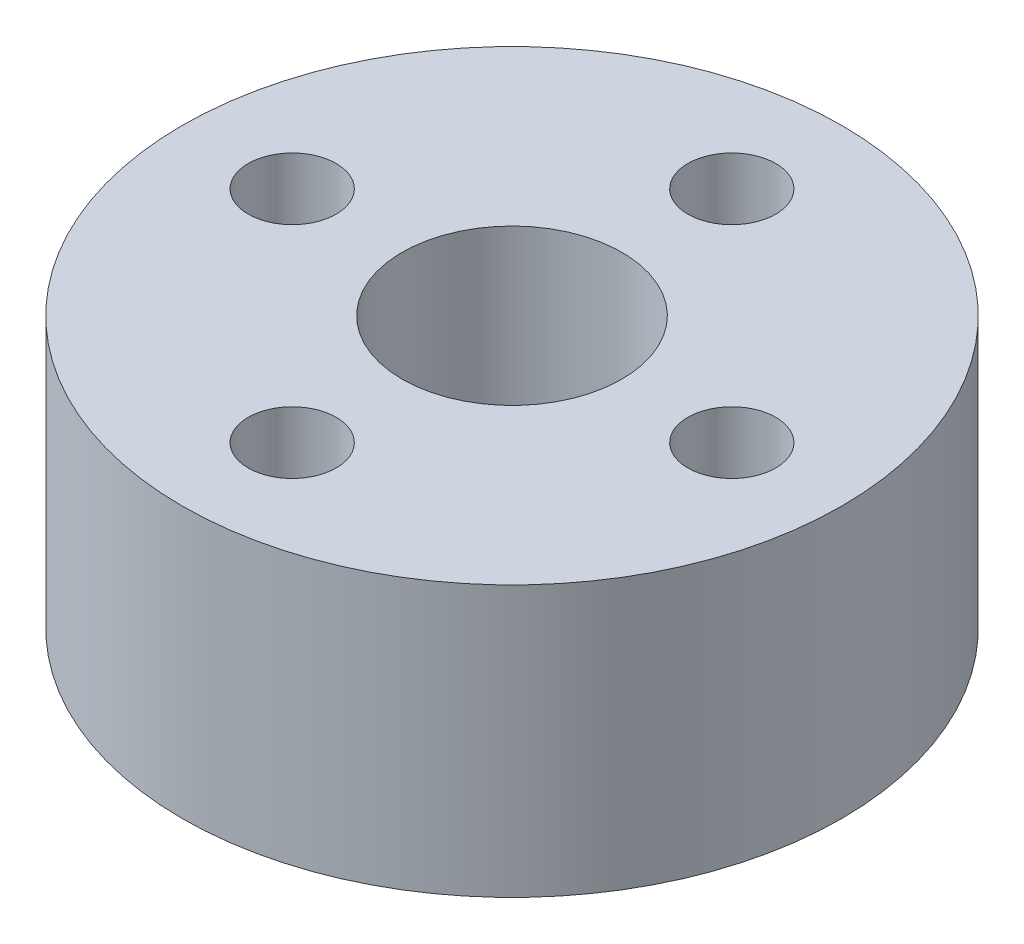
from build123d import *

# Parameters (mm, degrees)
SKETCH1_R           = 30
BOSS_EXTRUDE1_DEPTH = 50
SKETCH2_R           = 75
BOSS_EXTRUDE2_DEPTH = 50
SKETCH3_R           = 25
SKETCH3_R_2         = 10
CUT_EXTRUDE1_DEPTH  = 50
BOSS_EXTRUDE4_START = 11.56865
SKETCH5_R           = 75
SKETCH5_R_2         = 30
BOSS_EXTRUDE4_DEPTH = 11.56865


with BuildPart() as part:
    # Sketch1 → Boss-Extrude1 (new body)
    with BuildSketch(Plane(origin=(0, 0, 0), x_dir=(1, 0, 0), z_dir=(0, 1, 0))):
        with Locations(Location((0, 0, 0), (0, 0, 270))):
            Circle(SKETCH1_R)
    extrude(amount=BOSS_EXTRUDE1_DEPTH)

    # Sketch2 → Boss-Extrude2 (add)
    with BuildSketch(Plane(origin=(0, 0, 0), x_dir=(-1, 0, 0), z_dir=(0, -1, 0))):
        with Locations(Location((0, 0, 0), (0, 0, 90))):
            Circle(SKETCH2_R)
    extrude(amount=-BOSS_EXTRUDE2_DEPTH)

    # Sketch3 → Cut-Extrude1 (cut)
    with BuildSketch(Plane(origin=(0, 50, 0), x_dir=(1, 0, 0), z_dir=(0, 1, 0))):
        with Locations(Location((0, 0, 0), (0, 0, 270))):
            Circle(SKETCH3_R)
        with Locations(Location((0, -50, 0), (0, 0, 270))):
            Circle(SKETCH3_R_2)
        with Locations(Location((50, 0, 0), (0, 0, 270))):
            Circle(SKETCH3_R_2)
        with Locations(Location((0, 50, 0), (0, 0, 270))):
            Circle(SKETCH3_R_2)
        with Locations(Location((-50, 0, 0), (0, 0, 270))):
            Circle(SKETCH3_R_2)
    extrude(amount=-CUT_EXTRUDE1_DEPTH, mode=Mode.SUBTRACT)

    # Sketch5 → Boss-Extrude4 (add)
    with BuildSketch(Plane(origin=(0, 0, 0), x_dir=(-1, 0, 0), z_dir=(0, -1, 0)).offset(BOSS_EXTRUDE4_START)):
        with Locations(Location((0, 0, 0), (0, 0, 90))):
            Circle(SKETCH5_R)
        with Locations(Location((0, 0, 0), (0, 0, 90))):
            Circle(SKETCH5_R_2, mode=Mode.SUBTRACT)
    extrude(amount=-BOSS_EXTRUDE4_DEPTH)


solid = part.part
